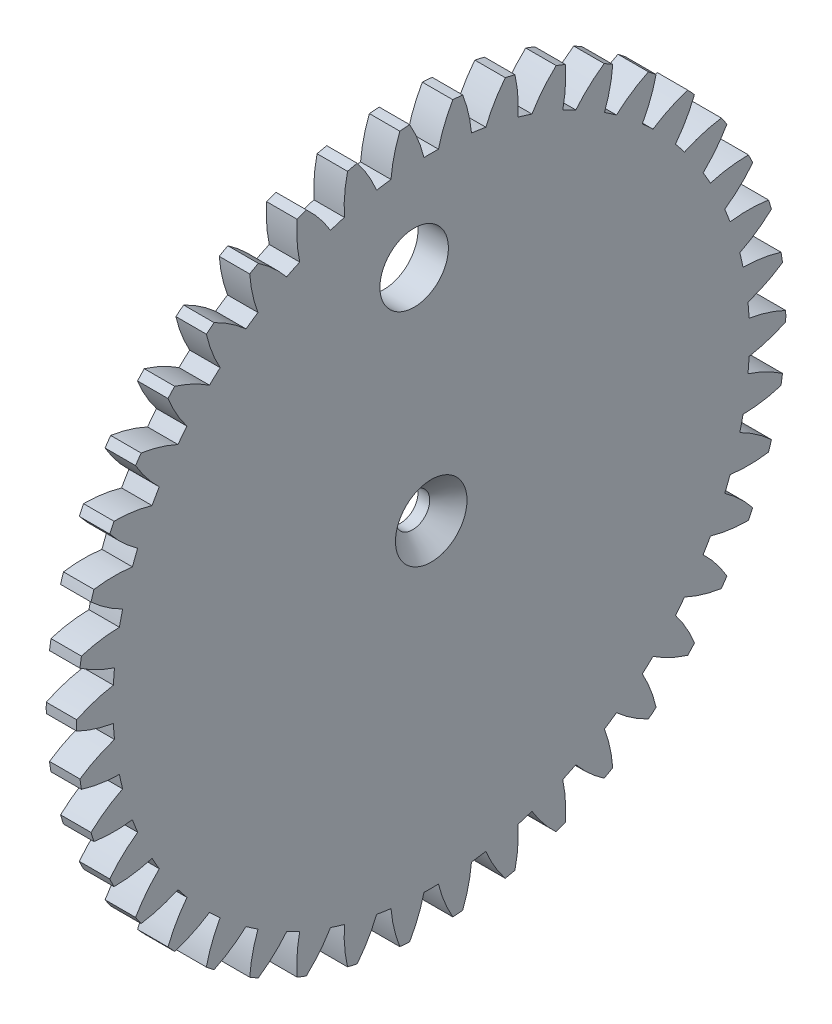
from build123d import *

# Parameters (mm, degrees)
BASPROSKE_W        = 4.000000128
BASPROSKE_H        = 46.566666667
TOOTHCUT_DEPTH     = 66.976578343
TEETHCUTS_COUNT    = 42
TEETHCUTS_ANGLE    = 351.428571429
SKETCH2_R          = 4.5
CUT_EXTRUDE2_DEPTH = 5


with BuildPart() as part:
    # BasProSke → Base-Revolve (revolve)
    with BuildSketch(Plane(origin=(0, 0, 0), x_dir=(1, 0, 0), z_dir=(0, 1, 0))):
        with Locations((2.000000064, 23.283333333)):
            Rectangle(BASPROSKE_W, BASPROSKE_H)
    revolve(axis=Axis((-10, 0, 0), (1, 0, 0)))

    # TooCutSke → ToothCut (cut, through all)
    with BuildSketch(Plane(origin=(0, 0, 0), x_dir=(0, 0, -1), z_dir=(1, 0, 0))):
        with BuildLine():
            ThreePointArc((0.952489555, 41.7920439), (0, 41.802896667), (-0.952489555, 41.7920439))
            ThreePointArc((-0.952489555, 41.7920439), (-1.730964675, 44.216533714), (-2.847793627, 46.504954013))
            ThreePointArc((-2.847793627, 46.504954013), (0, 46.592066667), (2.847793627, 46.504954013))
            ThreePointArc((2.847793627, 46.504954013), (1.730964675, 44.216533714), (0.952489555, 41.7920439))
        make_face()
    toothcut = extrude(amount=TOOTHCUT_DEPTH, mode=Mode.SUBTRACT)

    # TeethCuts: ToothCut ×42 about axis
    teethcuts_axis = Axis((-10, 0, 0), (1, 0, 0))
    for i in range(1, TEETHCUTS_COUNT):
        add(toothcut.rotate(teethcuts_axis, i * TEETHCUTS_ANGLE / (TEETHCUTS_COUNT - 1)), mode=Mode.SUBTRACT)

    # Sketch2 → Cut-Extrude2 (cut)
    with BuildSketch(Plane(origin=(4.000000128, 0, 0), x_dir=(0, 0, -1), z_dir=(1, 0, 0))):
        with Locations((-2.241902808, 29.916113915)):
            Circle(SKETCH2_R)
    extrude(amount=-CUT_EXTRUDE2_DEPTH, mode=Mode.SUBTRACT)

    # Sketch9 → CSK for M4 Flat Head Machine Screw1 (revolve, cut)
    with BuildSketch(Plane(origin=(4.000000128, 0, 0), x_dir=(0, 0, -1), z_dir=(0, 1, 0))):
        Polygon((0, 0), (0, 4.000000128), (2.25, 4.000000128), (2.25, 2.45), (4.7, 0), align=None)
    revolve(axis=Axis((10.350000128, 0, 0), (-1, 0, 0)), mode=Mode.SUBTRACT)


solid = part.part
